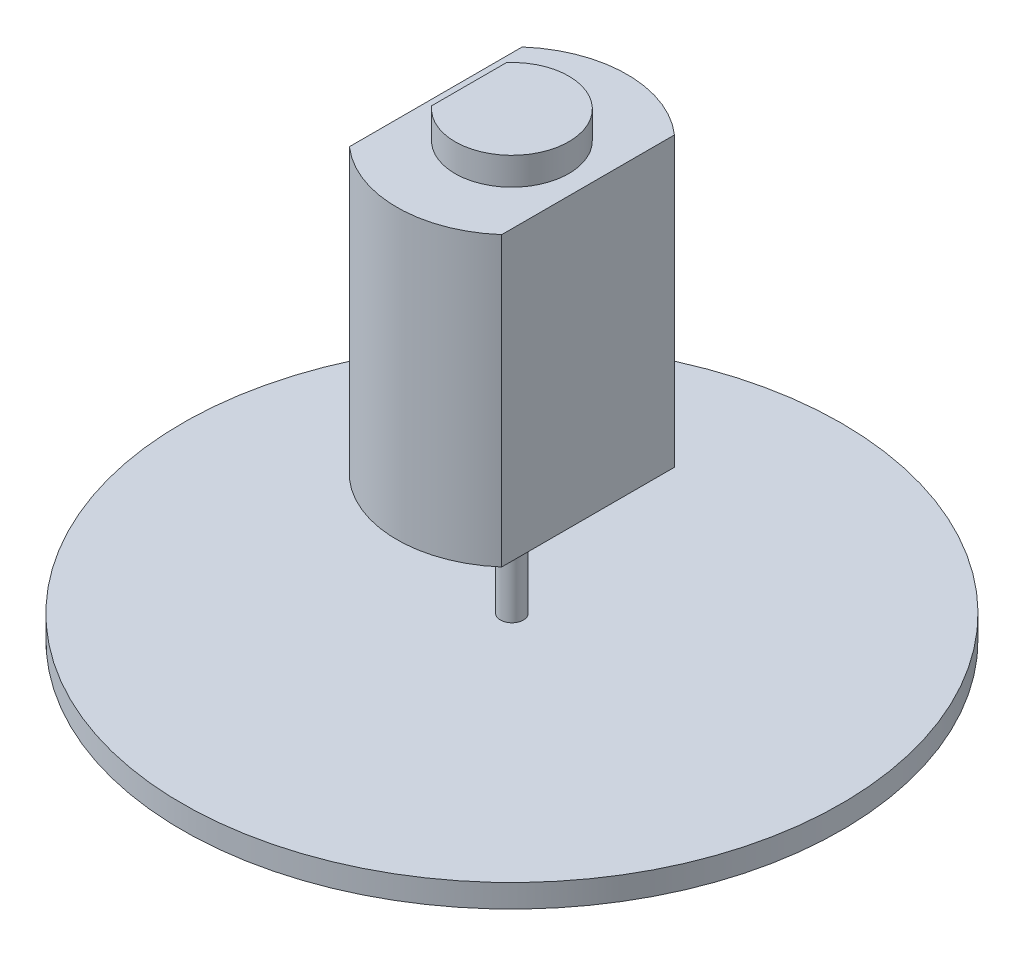
from build123d import *

# Parameters (mm, degrees)
BOSS_EXTRUDE1_DEPTH = 25
BOSS_EXTRUDE2_DEPTH = 2.4
SKETCH3_R           = 3
SKETCH3_R_2         = 1
BOSS_EXTRUDE3_DEPTH = 2.3
BOSS_EXTRUDE4_START = 2.3
SKETCH3_3_R         = 1
BOSS_EXTRUDE4_DEPTH = 8.25
SKETCH4_R           = 28.625
BOSS_EXTRUDE5_DEPTH = 2


with BuildPart() as part:
    # Sketch1 → Boss-Extrude1 (new body)
    with BuildSketch(Plane(origin=(0, 0, 0), x_dir=(1, 0, 0), z_dir=(0, 1, 0))):
        with BuildLine():
            Line((-6.614378278, -7.5), (-6.614378278, 7.5))
            ThreePointArc((-6.614378278, 7.5), (0, 10), (6.614378278, 7.5))
            Line((6.614378278, 7.5), (6.614378278, -7.5))
            ThreePointArc((6.614378278, -7.5), (0, -10), (-6.614378278, -7.5))
        make_face()
    extrude(amount=BOSS_EXTRUDE1_DEPTH)

    # Sketch2 → Boss-Extrude2 (add)
    with BuildSketch(Plane(origin=(0, 25, 0), x_dir=(1, 0, 0), z_dir=(0, 1, 0))):
        with BuildLine():
            Line((-3.720362886, 3.25), (-3.720362886, -3.25))
            ThreePointArc((-3.720362886, -3.25), (4.94, 0), (-3.720362886, 3.25))
        make_face()
    extrude(amount=BOSS_EXTRUDE2_DEPTH)

    # Sketch3 → Boss-Extrude3 (add)
    # profile 1 of 2: a face of its own
    with BuildSketch(Plane.XZ):
        with Locations(Location((0, 0, 0), (0, 0, 270))):
            Circle(SKETCH3_R)
        Circle(SKETCH3_R_2, mode=Mode.SUBTRACT)
    # profile 2 of 2: a face of its own
    with BuildSketch(Plane.XZ):
        Circle(SKETCH3_R_2)
    extrude(amount=BOSS_EXTRUDE3_DEPTH)

    # Sketch3<3> → Boss-Extrude4 (add)
    with BuildSketch(Plane.XZ.offset(BOSS_EXTRUDE4_START)):
        with Locations(Location((0, 0, 0), (0, 0, 270))):
            Circle(SKETCH3_3_R)
    extrude(amount=BOSS_EXTRUDE4_DEPTH)

    # Sketch4 → Boss-Extrude5 (add)
    with BuildSketch(Plane(origin=(0, -10.55, 0), x_dir=(-1, 0, 0), z_dir=(0, -1, 0))):
        with Locations(Location((0, 0, 0), (0, 0, 90))):
            Circle(SKETCH4_R)
    extrude(amount=BOSS_EXTRUDE5_DEPTH)


solid = part.part
